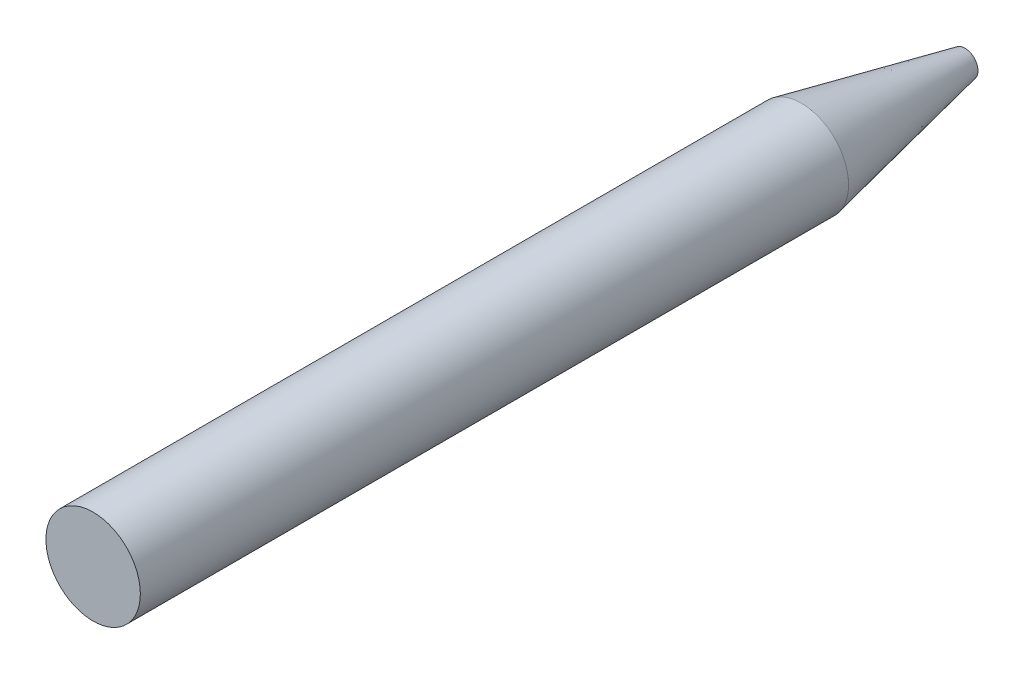
from build123d import *

# Parameters (mm, degrees)
SKETCH1_R           = 25.4
BOSS_EXTRUDE3_DEPTH = 381


with BuildPart() as part:
    # Sketch1 → Boss-Extrude3 (new body)
    with BuildSketch(Plane.XY):
        Circle(SKETCH1_R)
    extrude(amount=BOSS_EXTRUDE3_DEPTH)

    # Sketch2 → Revolve1 (revolve)
    with BuildSketch(Plane(origin=(0, 0, 0), x_dir=(1, 0, 0), z_dir=(0, 1, 0)), mode=Mode.PRIVATE) as revolve1_sk:
        Polygon((-25.4, 0), (0, 0), (0, 88.011174877), (-7.010963676, 88.011174877), align=None)
    revolve(revolve1_sk.sketch.rotate(Axis((0, 0, 0), (0, 0, -1)), 180), axis=Axis((0, 0, 0), (0, 0, -1)))


solid = part.part
